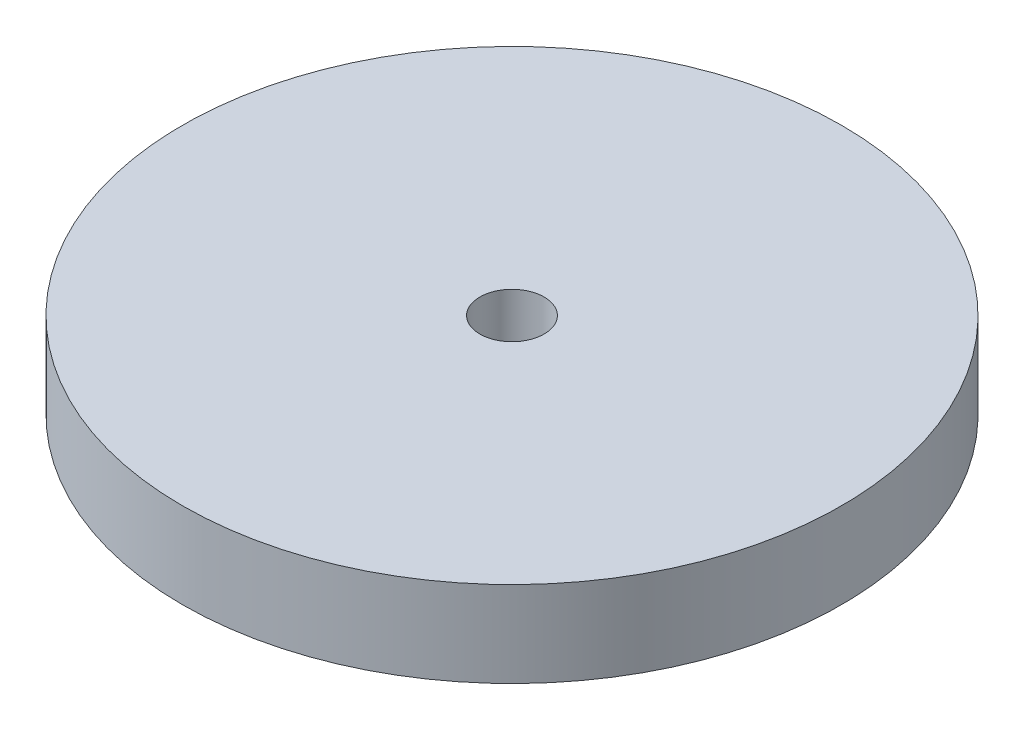
from build123d import *

# Parameters (mm, degrees)
SKETCH1_R           = 76.895
BOSS_EXTRUDE1_DEPTH = 20
CUT_EXTRUDE1_REACH  = 112.57
SKETCH2_R           = 7.5


with BuildPart() as part:
    # Sketch1 → Boss-Extrude1 (new body)
    with BuildSketch(Plane(origin=(0, 0, 0), x_dir=(1, 0, 0), z_dir=(0, 1, 0))):
        with Locations(Location((0, 0, 0), (0, 0, 270))):
            Circle(SKETCH1_R)
    extrude(amount=BOSS_EXTRUDE1_DEPTH)

    # Sketch2 → Cut-Extrude1 (cut, up to next)
    with BuildSketch(Plane(origin=(0, 20, 0), x_dir=(1, 0, 0), z_dir=(0, 1, 0)), mode=Mode.PRIVATE) as cut_extrude1_sk1:
        with Locations(Location((0, 0, 0), (0, 0, 270))):
            Circle(SKETCH2_R)
    cut_extrude1_tool1 = extrude(cut_extrude1_sk1.sketch, amount=-CUT_EXTRUDE1_REACH, mode=Mode.PRIVATE) & part.part
    add(cut_extrude1_tool1.solids().sort_by_distance((0, 20, 0))[0], mode=Mode.SUBTRACT)


solid = part.part
